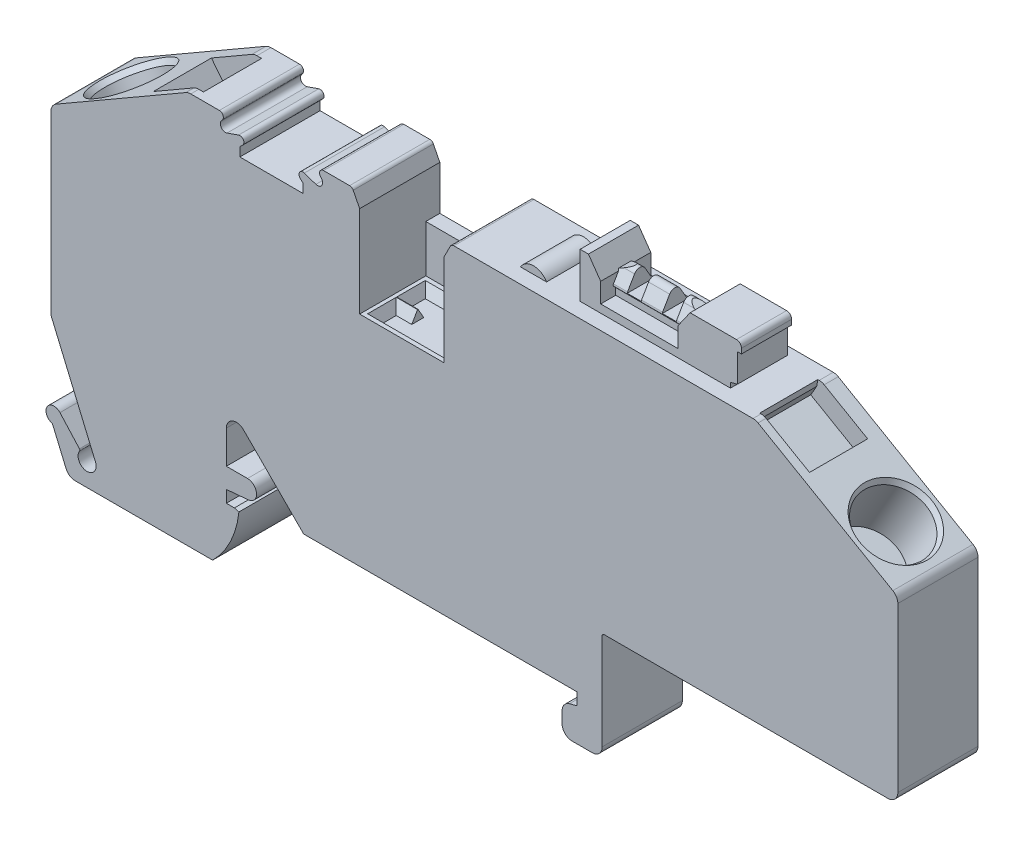
from build123d import *

# Parameters (mm, degrees)
EXTRUDE1_DEPTH       = 8
SKETCH2_W            = 8.4
SKETCH2_H            = 4.7
EXTRUDE2_DEPTH       = 1.4
EXTRUDE3_DEPTH       = 4.2
EXTRUDE3_DEPTH_BACK  = 4.2
EXTRUDE4_DEPTH       = 4.2
EXTRUDE4_DEPTH_BACK  = 4.2
EXTRUDE5_DEPTH       = 1.7
EXTRUDE5_DEPTH_BACK  = 1.7
SKETCH5_W            = 2
SKETCH5_H            = 1
EXTRUDE6_DEPTH       = 8
EXTRUDE7_DEPTH       = 8
EXTRUDE8_DEPTH       = 5.8
EXTRUDE9_DEPTH       = 5.8
EXTRUDE10_DEPTH      = 2.5
EXTRUDE10_DEPTH_BACK = 2.5
EXTRUDE11_DEPTH      = 5
EXTRUDE11_DEPTH_BACK = 5
EXTRUDE12_DEPTH      = 1.5
EXTRUDE12_DEPTH_BACK = 1.5


with BuildPart() as part:
    # Sketch1 → Extrude1 (new body)
    with BuildSketch(Plane.XY):
        with BuildLine():
            Line((-34.824054735, -3.072067398), (-33.500260521, -6.190731128))
            ThreePointArc((-33.500260521, -6.190731128), (-33.131692653, -6.633885822), (-32.579755667, -6.8))
            Line((-32.579755667, -6.8), (-18.872283192, -6.8))
            ThreePointArc((-18.872283192, -6.8), (-17.083537757, -4.288835387), (-16.247280004, -1.321305957))
            Line((-16.247280004, -1.321305957), (-16.7, -1.2))
            Line((-16.7, -1.2), (-17.5, -1.2))
            Line((-17.5, -1.2), (-17.5, 0))
            Line((-17.5, 0), (-15.311743878, 0.191447604))
            ThreePointArc((-15.311743878, 0.191447604), (-14.485569293, 1.133519165), (-15.390706981, 2))
            Line((-15.390706981, 2), (-17.5, 2))
            Line((-17.5, 2), (-17.5, 5.3))
            ThreePointArc((-17.5, 5.3), (-16.882683432, 6.223879533), (-15.792893219, 6.007106781))
            Line((-15.792893219, 6.007106781), (-9.785786438, 0))
            Line((-9.785786438, 0), (17.5, 0))
            Line((17.5, 0), (17.5, -1.2))
            Line((17.5, -1.2), (16.741180955, -1.40332495))
            ThreePointArc((16.741180955, -1.40332495), (16.20664666, -1.760489348), (16, -2.369250777))
            Line((16, -2.369250777), (16, -3.5))
            ThreePointArc((16, -3.5), (16.292893219, -4.207106781), (17, -4.5))
            Line((17, -4.5), (19, -4.5))
            ThreePointArc((19, -4.5), (19.707106781, -4.207106781), (20, -3.5))
            Line((20, -3.5), (20, 6.1))
            ThreePointArc((20, 6.1), (20.058578644, 6.241421356), (20.2, 6.3))
            Line((20.2, 6.3), (48.5, 6.3))
            ThreePointArc((48.5, 6.3), (49.207106781, 6.592893219), (49.5, 7.3))
            Line((49.5, 7.3), (49.5, 23.635680518))
            ThreePointArc((49.5, 23.635680518), (49.366025404, 24.135680518), (49, 24.501705922))
            Line((49, 24.501705922), (35.551804172, 32.266025404))
            ThreePointArc((35.551804172, 32.266025404), (35.310623217, 32.365925826), (35.051804172, 32.4))
            Line((35.051804172, 32.4), (5.2, 32.4))
            ThreePointArc((5.2, 32.4), (4.990511031, 32.340755589), (4.843077314, 32.180571859))
            Line((4.843077314, 32.180571859), (4.2, 30.909449746))
            Line((4.2, 30.909449746), (4.2, 21.8))
            Line((4.2, 21.8), (-4.2, 21.8))
            Line((-4.2, 21.8), (-4.2, 30.909449746))
            Line((-4.2, 30.909449746), (-4.843077314, 32.180571859))
            ThreePointArc((-4.843077314, 32.180571859), (-4.990511031, 32.340755589), (-5.2, 32.4))
            Line((-5.2, 32.4), (-7.8, 32.4))
            ThreePointArc((-7.8, 32.4), (-8.157770876, 32.178885438), (-8.12, 31.76))
            Line((-8.12, 31.76), (-8, 31.6))
            ThreePointArc((-8, 31.6), (-7.996119463, 31.005244998), (-8.563727578, 30.827566639))
            Line((-8.563727578, 30.827566639), (-9.719017938, 31.227946689))
            ThreePointArc((-9.719017938, 31.227946689), (-10.189007481, 31.062306212), (-10.132842712, 30.567157288))
            Line((-10.132842712, 30.567157288), (-9.85, 30.284314575))
            Line((-9.85, 30.284314575), (-9.85, 29.4))
            Line((-9.85, 29.4), (-13, 29.4))
            Line((-13, 29.4), (-16.15, 29.4))
            Line((-16.15, 29.4), (-16.15, 30.284314575))
            Line((-16.15, 30.284314575), (-15.867157288, 30.567157288))
            ThreePointArc((-15.867157288, 30.567157288), (-15.810992519, 31.062306212), (-16.280982062, 31.227946689))
            Line((-16.280982062, 31.227946689), (-17.436272422, 30.827566639))
            ThreePointArc((-17.436272422, 30.827566639), (-18.003880537, 31.005244998), (-18, 31.6))
            Line((-18, 31.6), (-17.88, 31.76))
            ThreePointArc((-17.88, 31.76), (-17.842229124, 32.178885438), (-18.2, 32.4))
            Line((-18.2, 32.4), (-21.051804172, 32.4))
            ThreePointArc((-21.051804172, 32.4), (-21.310623217, 32.365925826), (-21.551804172, 32.266025404))
            Line((-21.551804172, 32.266025404), (-34.5, 24.790381057))
            ThreePointArc((-34.5, 24.790381057), (-34.866025404, 24.424355653), (-35, 23.924355653))
            Line((-35, 23.924355653), (-35, 6.3))
            Line((-35, 6.3), (-30.564941956, -4.148341984))
            ThreePointArc((-30.564941956, -4.148341984), (-31.474501075, -5.396338117), (-32.145272576, -4.005346482))
            ThreePointArc((-32.145272576, -4.005346482), (-32.121013363, -3.911579893), (-32.15911356, -3.822534638))
            Line((-32.15911356, -3.822534638), (-34.102040633, -1.664695515))
            ThreePointArc((-34.102040633, -1.664695515), (-35.366900567, -1.76337794), (-34.945835863, -2.960170899))
            ThreePointArc((-34.945835863, -2.960170899), (-34.872837521, -3.002941804), (-34.824054735, -3.072067398))
        make_face()
    extrude(amount=EXTRUDE1_DEPTH)

    # Sketch2 → Extrude2 (add)
    with BuildSketch(Plane.XY):
        with Locations((0, 24.15)):
            Rectangle(SKETCH2_W, SKETCH2_H)
    extrude(amount=EXTRUDE2_DEPTH)

    # Sketch3 → Extrude3 (cut, two sides: drawn at the far end of the back side and taken through both)
    with BuildSketch(Plane(origin=(0, 0, 0), x_dir=(0, 0, -1), z_dir=(1, 0, 0)).offset(-EXTRUDE3_DEPTH_BACK)):
        Polygon((-7.577350269, 21.8), (-7, 20.8), (-5.3, 20.8), (-4.722649731, 21.8), align=None)
    extrude(amount=EXTRUDE3_DEPTH + EXTRUDE3_DEPTH_BACK, mode=Mode.SUBTRACT)

    # Sketch4 → Extrude4 (cut, two sides: drawn at the far end of the back side and taken through both)
    with BuildSketch(Plane(origin=(0, 0, 0), x_dir=(0, 0, -1), z_dir=(1, 0, 0)).offset(-EXTRUDE4_DEPTH_BACK)):
        Polygon((-4.677350269, 21.8), (-4.1, 20.8), (-2.4, 20.8), (-1.822649731, 21.8), align=None)
    extrude(amount=EXTRUDE4_DEPTH + EXTRUDE4_DEPTH_BACK, mode=Mode.SUBTRACT)

    # Sketch5 → Extrude5 (cut, two sides: drawn at the far end of the back side and taken through both)
    with BuildSketch(Plane(origin=(0, 0, 0), x_dir=(0, 0, -1), z_dir=(1, 0, 0)).offset(-EXTRUDE5_DEPTH_BACK)):
        with Locations((-4.7, 21.3)):
            Rectangle(SKETCH5_W, SKETCH5_H)
    extrude(amount=EXTRUDE5_DEPTH + EXTRUDE5_DEPTH_BACK, mode=Mode.SUBTRACT)

    # Sketch6 → Extrude6 (add)
    with BuildSketch(Plane.XY):
        Polygon((3.25, 20.8), (4.2, 20.8), (4.2, 21.8), (3.827350269, 21.8), align=None)
    extrude(amount=EXTRUDE6_DEPTH)

    # Sketch7 → Extrude7 (add)
    with BuildSketch(Plane.XY):
        Polygon((-4.2, 21.8), (-4.2, 20.8), (-3.25, 20.8), (-3.827350269, 21.8), align=None)
    extrude(amount=EXTRUDE7_DEPTH)

    # Sketch8 → Cut-Revolve1 (revolve, cut)
    with BuildSketch(Plane.XY.offset(4), mode=Mode.PRIVATE) as cut_revolve1_sk:
        Polygon((42.127146997, 21.137401035), (39.269263165, 22.787401035), (42.184455543, 27.836662349), (42.184455543, 28.436662349), (45.302146997, 26.636662349), align=None)
    revolve(cut_revolve1_sk.sketch.rotate(Axis((45.302146997, 26.636662349, 4), (-0.4999999999999722, -0.8660254037844548, 0)), 180), axis=Axis((45.302146997, 26.636662349, 4), (-0.4999999999999722, -0.8660254037844548, 0)), mode=Mode.SUBTRACT)

    # Sketch9 → Cut-Revolve2 (revolve, cut)
    with BuildSketch(Plane.XY.offset(4), mode=Mode.PRIVATE) as cut_revolve2_sk:
        Polygon((-31.002146997, 26.80986743), (-27.884455543, 28.60986743), (-27.884455543, 28.00986743), (-24.969263165, 22.960606116), (-27.827146997, 21.310606116), align=None)
    revolve(cut_revolve2_sk.sketch.rotate(Axis((-27.827146997, 21.310606116, 4), (-0.49999999999997385, 0.8660254037844538, 0)), 180), axis=Axis((-27.827146997, 21.310606116, 4), (-0.49999999999997385, 0.8660254037844538, 0)), mode=Mode.SUBTRACT)

    # Sketch10 → Extrude8 (cut)
    with BuildSketch(Plane.XY.offset(1.4)):
        Polygon((34.212951043, 30.729611541), (38.646064357, 28.170152376), (39.889488223, 29.761662349), (34.953143422, 32.611662349), (34.80082943, 31.747846776), align=None)
    extrude(amount=EXTRUDE8_DEPTH, mode=Mode.SUBTRACT)

    # Sketch11 → Extrude9 (cut)
    with BuildSketch(Plane.XY.offset(1.4)):
        Polygon((-25.589488223, 29.93486743), (-24.346064357, 28.343357457), (-19.912951043, 30.902816622), (-20.50082943, 31.921051857), (-20.653143422, 32.78486743), align=None)
    extrude(amount=EXTRUDE9_DEPTH, mode=Mode.SUBTRACT)

    # Sketch12 → Extrude10 (add, two sides: drawn at the far end of the back side and taken through both)
    with BuildSketch(Plane.XY.offset(4).offset(-EXTRUDE10_DEPTH_BACK)):
        with BuildLine():
            Line((10.15, 31.65), (31.3, 31.65))
            Line((31.3, 31.65), (31.3, 32.9))
            Line((31.3, 32.9), (32, 33.087564435))
            Line((32, 33.087564435), (32, 35.9))
            Line((32, 35.9), (32.4, 35.9))
            Line((32.4, 35.9), (32.4, 36.4))
            ThreePointArc((32.4, 36.4), (32.253553391, 36.753553391), (31.9, 36.9))
            Line((31.9, 36.9), (27.270332061, 36.9))
            Line((27.270332061, 36.9), (26.05, 35.157185199))
            Line((26.05, 35.157185199), (26.05, 33.2))
            Line((26.05, 33.2), (18.35, 33.2))
            Line((18.35, 33.2), (18.35, 35.157185199))
            Line((18.35, 35.157185199), (17.129667939, 36.9))
            Line((17.129667939, 36.9), (16.3, 36.9))
            Line((16.3, 36.9), (16.3, 32.4))
            Line((16.3, 32.4), (12.949038106, 32.4))
            ThreePointArc((12.949038106, 32.4), (11.261771432, 33.098888739), (10.15, 31.65))
        make_face()
    extrude(amount=EXTRUDE10_DEPTH + EXTRUDE10_DEPTH_BACK)

    # Sketch13 → Extrude11 (add, two sides: drawn at the far end of the back side and taken through both)
    with BuildSketch(Plane(origin=(22.2, 0, 0), x_dir=(0, 0, -1), z_dir=(1, 0, 0)).offset(-EXTRUDE11_DEPTH_BACK)):
        with BuildLine():
            Line((-5.15, 34.026794919), (-5, 33.940192379))
            Line((-5, 33.940192379), (-5, 33.2))
            Line((-5, 33.2), (-3, 33.2))
            Line((-3, 33.2), (-3, 33.940192379))
            Line((-3, 33.940192379), (-2.85, 34.026794919))
            ThreePointArc((-2.85, 34.026794919), (-2.756642553, 34.14888349), (-2.777468634, 34.301157934))
            Line((-2.777468634, 34.301157934), (-3.482405902, 35.503473803))
            ThreePointArc((-3.482405902, 35.503473803), (-4, 35.8), (-4.517594098, 35.503473803))
            Line((-4.517594098, 35.503473803), (-5.222531366, 34.301157934))
            ThreePointArc((-5.222531366, 34.301157934), (-5.243357447, 34.14888349), (-5.15, 34.026794919))
        make_face()
    extrude(amount=EXTRUDE11_DEPTH + EXTRUDE11_DEPTH_BACK)

    # Sketch14 → Extrude12 (cut, two sides: drawn at the far end of the back side and taken through both)
    with BuildSketch(Plane.XY.offset(4).offset(-EXTRUDE12_DEPTH_BACK)):
        Polygon((17.129667939, 36.9), (18.25, 35.3), (19.32225346, 35.8), (19.75, 35.8), (19.75, 34.2), (21.15, 34.2), (21.15, 35.8), (23.25, 35.8), (23.25, 34.2), (24.65, 34.2), (24.65, 35.8), (25.07774654, 35.8), (26.15, 35.3), (27.270332061, 36.9), (22.2, 36.9), align=None)
    extrude(amount=EXTRUDE12_DEPTH + EXTRUDE12_DEPTH_BACK, mode=Mode.SUBTRACT)


solid = part.part
